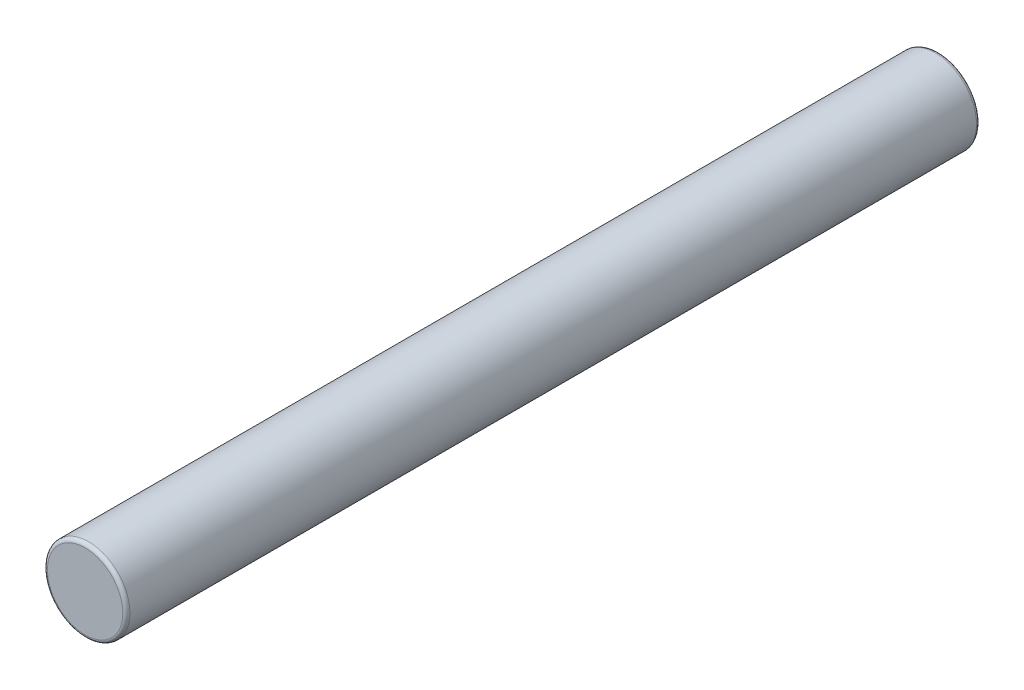
from build123d import *

# Parameters (mm, degrees)
SKETCH1_R           = 2.9
BOSS_EXTRUDE1_DEPTH = 60
FILLET4_R           = 0.25


with BuildPart() as part:
    # Sketch1 → Boss-Extrude1 (new body)
    with BuildSketch(Plane.XY):
        Circle(SKETCH1_R)
    extrude(amount=BOSS_EXTRUDE1_DEPTH)

    # Fillet4
    fillet4_edges = [part.edges().sort_by_distance(p)[0] for p in [
        (-2.9, 0, 0),
        (-2.9, 0, 60),
    ]]
    fillet(fillet4_edges, radius=FILLET4_R)


solid = part.part
